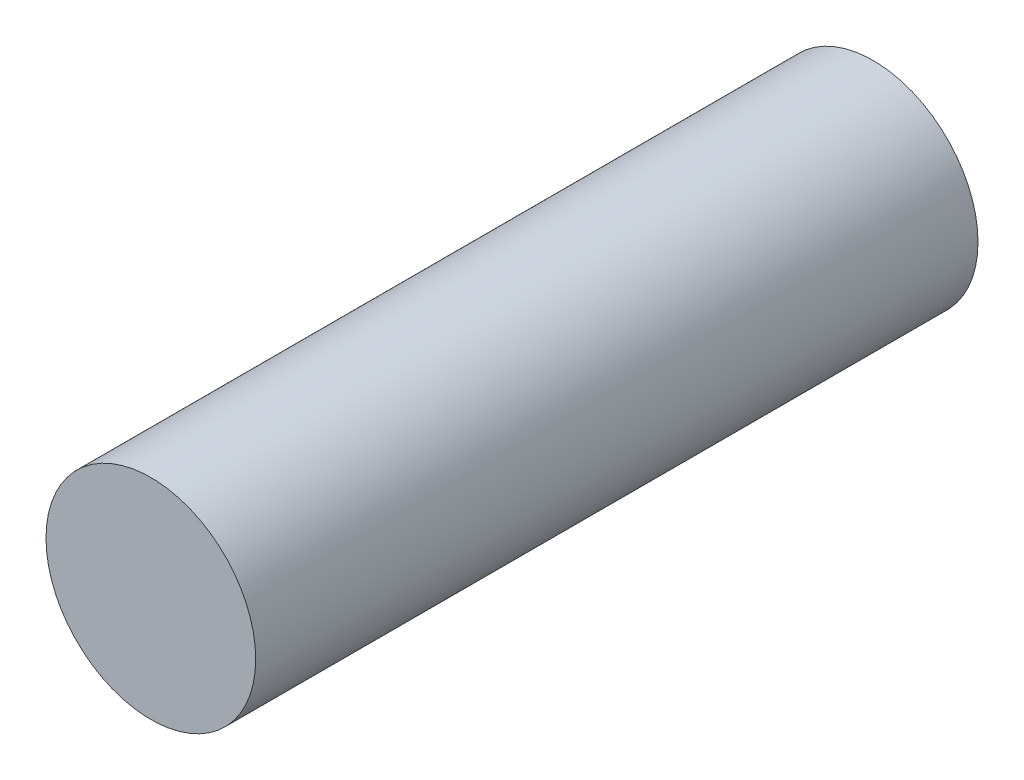
from build123d import *

# Parameters (mm, degrees)
SKETCH1_R           = 4.5
BOSS_EXTRUDE1_DEPTH = 31


with BuildPart() as part:
    # Sketch1 → Boss-Extrude1 (new body)
    with BuildSketch(Plane.XY):
        with Locations((-4.409659016, 2.932163615)):
            Circle(SKETCH1_R)
    extrude(amount=BOSS_EXTRUDE1_DEPTH)


solid = part.part
